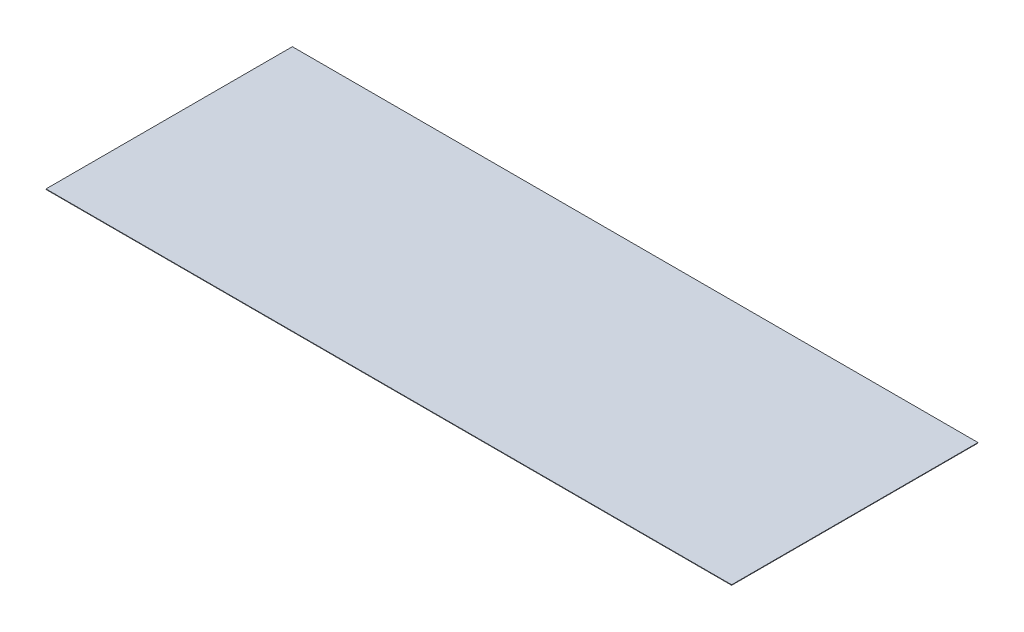
from build123d import *

# Parameters (mm, degrees)
SKETCH1_W           = 113
SKETCH1_H           = 40.6
BOSS_EXTRUDE1_DEPTH = 0.08


with BuildPart() as part:
    # Sketch1 → Boss-Extrude1 (new body)
    with BuildSketch(Plane(origin=(0, 0, 0), x_dir=(1, 0, 0), z_dir=(0, 1, 0))):
        Rectangle(SKETCH1_W, SKETCH1_H)
    extrude(amount=BOSS_EXTRUDE1_DEPTH)


solid = part.part
